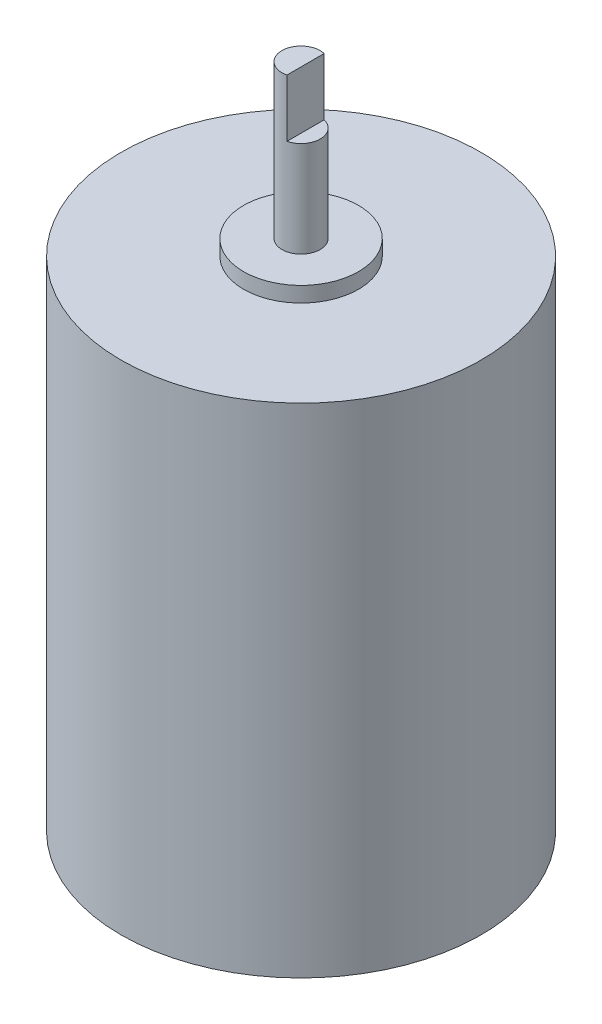
from build123d import *

# Parameters (mm, degrees)
SKETCH1_R           = 23.5
BOSS_EXTRUDE1_DEPTH = 65
SKETCH2_R           = 7.5
BOSS_EXTRUDE2_DEPTH = 2
SKETCH3_R           = 2.5
BOSS_EXTRUDE3_DEPTH = 20
CUT_EXTRUDE2_START  = -7.5
CUT_EXTRUDE2_DEPTH  = 7.5


with BuildPart() as part:
    # Sketch1 → Boss-Extrude1 (new body)
    with BuildSketch(Plane(origin=(0, 0, 0), x_dir=(1, 0, 0), z_dir=(0, 1, 0))):
        with Locations(Location((0, 0, 0), (0, 0, 270))):
            Circle(SKETCH1_R)
    extrude(amount=BOSS_EXTRUDE1_DEPTH)

    # Sketch2 → Boss-Extrude2 (add)
    with BuildSketch(Plane(origin=(0, 65, 0), x_dir=(1, 0, 0), z_dir=(0, 1, 0))):
        with Locations(Location((0, 0, 0), (0, 0, 270))):
            Circle(SKETCH2_R)
    extrude(amount=BOSS_EXTRUDE2_DEPTH)

    # Sketch3 → Boss-Extrude3 (add)
    with BuildSketch(Plane(origin=(0, 67, 0), x_dir=(1, 0, 0), z_dir=(0, 1, 0))):
        with Locations(Location((0, 0, 0), (0, 0, 270))):
            Circle(SKETCH3_R)
    extrude(amount=BOSS_EXTRUDE3_DEPTH)

    # Sketch4 → Cut-Extrude2 (cut)
    with BuildSketch(Plane(origin=(0, 87, 0), x_dir=(1, 0, 0), z_dir=(0, 1, 0)).offset(CUT_EXTRUDE2_START)):
        with BuildLine():
            Line((0.591953549, 2.428907367), (0.591953549, -2.428907367))
            ThreePointArc((0.591953549, -2.428907367), (2.5, 0), (0.591953549, 2.428907367))
        make_face()
    extrude(amount=CUT_EXTRUDE2_DEPTH, mode=Mode.SUBTRACT)


solid = part.part
